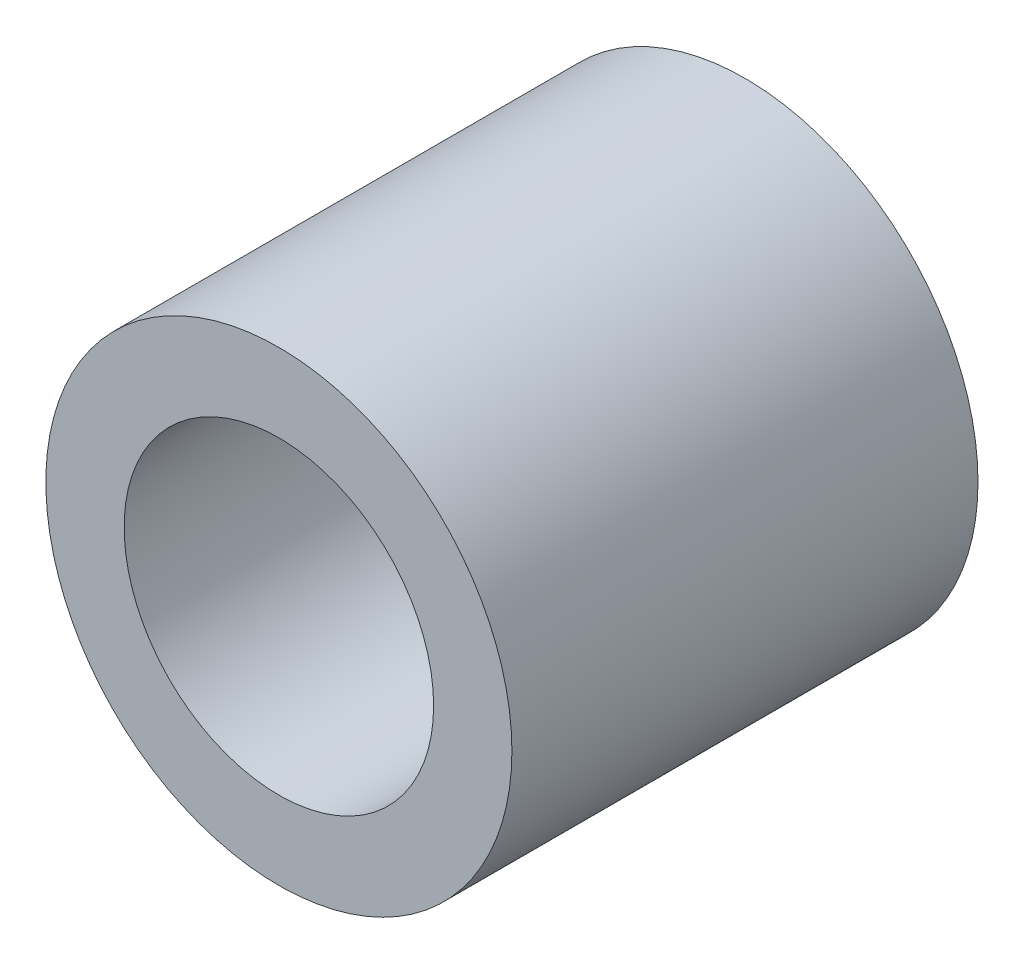
from build123d import *

# Parameters (mm, degrees)
SKETCH1_W = 6.35
SKETCH1_H = 1.0668


with BuildPart() as part:
    # Sketch1 → Revolve1 (revolve)
    with BuildSketch(Plane(origin=(0, 0, 0), x_dir=(0, 0, -1), z_dir=(1, 0, 0)), mode=Mode.PRIVATE) as revolve1_sk:
        with Locations((0, 2.6416)):
            Rectangle(SKETCH1_W, SKETCH1_H)
    revolve(revolve1_sk.sketch.rotate(Axis((0, 0, 43.465184419), (0, 0, -1)), 90), axis=Axis((0, 0, 43.465184419), (0, 0, -1)))


solid = part.part
